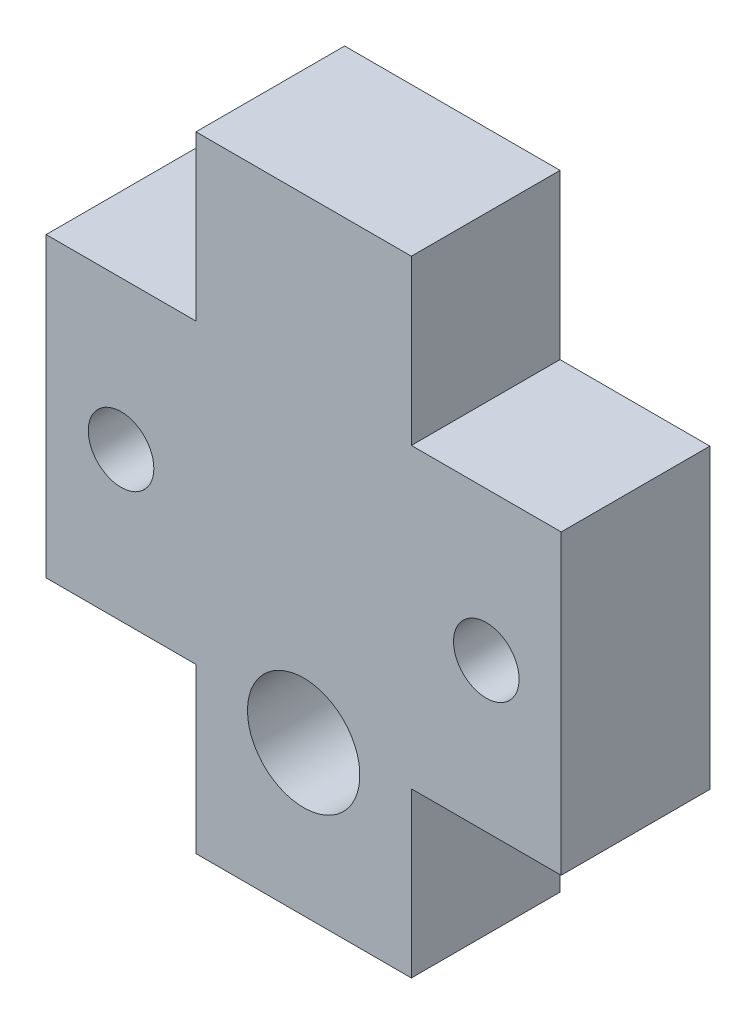
from build123d import *

# Parameters (mm, degrees)
SKETCH1_W           = 6.4
SKETCH1_H           = 12.7
SKETCH1_R           = 1.4
BOSS_EXTRUDE1_DEPTH = 6.35
SKETCH2_R           = 2.4
CUT_EXTRUDE1_DEPTH  = 19.426746864


with BuildPart() as part:
    # Sketch1 → Boss-Extrude1 (new body)
    # profile 1 of 5: a face of its own
    with BuildSketch(Plane.XY):
        Polygon((-4.6, 13.35), (-4.6, 6.35), (-4.6, -6.35), (-4.6, -13.35), (4.6, -13.35), (4.6, -6.35), (4.6, 6.35), (4.6, 13.35), align=None)
    # profile 2 of 5: a face of its own
    with BuildSketch(Plane.XY):
        Polygon((-4.6, 13.35), (-4.6, 6.35), (-4.6, -6.35), (-4.6, -13.35), (4.6, -13.35), (4.6, -6.35), (4.6, 6.35), (4.6, 13.35), align=None)
    # profile 3 of 5: a face of its own
    with BuildSketch(Plane.XY):
        Polygon((-4.6, 13.35), (-4.6, 6.35), (-4.6, -6.35), (-4.6, -13.35), (4.6, -13.35), (4.6, -6.35), (4.6, 6.35), (4.6, 13.35), align=None)
    # profile 4 of 5: a face of its own
    with BuildSketch(Plane.XY):
        with Locations((7.8, 0)):
            Rectangle(SKETCH1_W, SKETCH1_H)
        with Locations((7.8, 0)):
            Circle(SKETCH1_R, mode=Mode.SUBTRACT)
    # profile 5 of 5: a face of its own
    with BuildSketch(Plane.XY):
        with Locations((-7.8, 0)):
            Rectangle(SKETCH1_W, SKETCH1_H)
        with Locations((-7.8, 0)):
            Circle(SKETCH1_R, mode=Mode.SUBTRACT)
    extrude(amount=BOSS_EXTRUDE1_DEPTH)

    # Sketch2 → Cut-Extrude1 (cut, through all)
    with BuildSketch(Plane(origin=(0, 0, 0), x_dir=(-1, 0, 0), z_dir=(0, 0, -1))):
        with Locations((0, -6.95)):
            Circle(SKETCH2_R)
    extrude(amount=-CUT_EXTRUDE1_DEPTH, mode=Mode.SUBTRACT)


solid = part.part
